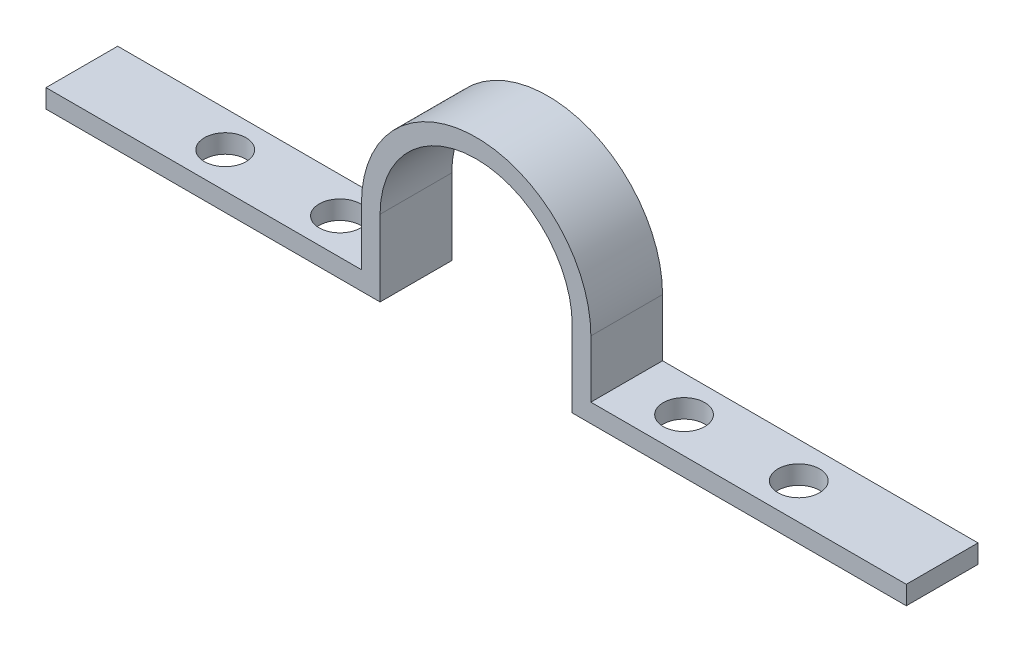
from build123d import *

# Parameters (mm, degrees)
BOSS_EXTRUDE1_DEPTH = 25
SKETCH4_R           = 7.25
CUT_EXTRUDE1_DEPTH  = 25


with BuildPart() as part:
    # Sketch1 → Boss-Extrude1 (new body)
    with BuildSketch(Plane.XY):
        with BuildLine():
            Line((150, 0), (150, 6.5))
            Line((150, 6.5), (40, 6.5))
            Line((40, 6.5), (40, 26.5))
            ThreePointArc((40, 26.5), (0, 66.5), (-40, 26.5))
            Line((-40, 26.5), (-40, 6.5))
            Line((-40, 6.5), (-150, 6.5))
            Line((-150, 6.5), (-150, 0))
            Line((-150, 0), (-33.5, 0))
            Line((-33.5, 0), (-33.5, 26.5))
            ThreePointArc((-33.5, 26.5), (0, 60), (33.5, 26.5))
            Line((33.5, 26.5), (33.5, 0))
            Line((33.5, 0), (150, 0))
        make_face()
    extrude(amount=BOSS_EXTRUDE1_DEPTH)

    # Sketch4 → Cut-Extrude1 (cut)
    with BuildSketch(Plane(origin=(0, 0, 0), x_dir=(1, 0, 0), z_dir=(0, 1, 0))):
        with Locations((-60, -12.5)):
            Circle(SKETCH4_R)
        with Locations((-100, -12.5)):
            Circle(SKETCH4_R)
        with Locations(Location((60, -12.5, 0), (0, 0, 90))):
            Circle(SKETCH4_R)
        with Locations(Location((100, -12.5, 0), (0, 0, 90))):
            Circle(SKETCH4_R)
    extrude(amount=CUT_EXTRUDE1_DEPTH, mode=Mode.SUBTRACT)


solid = part.part
